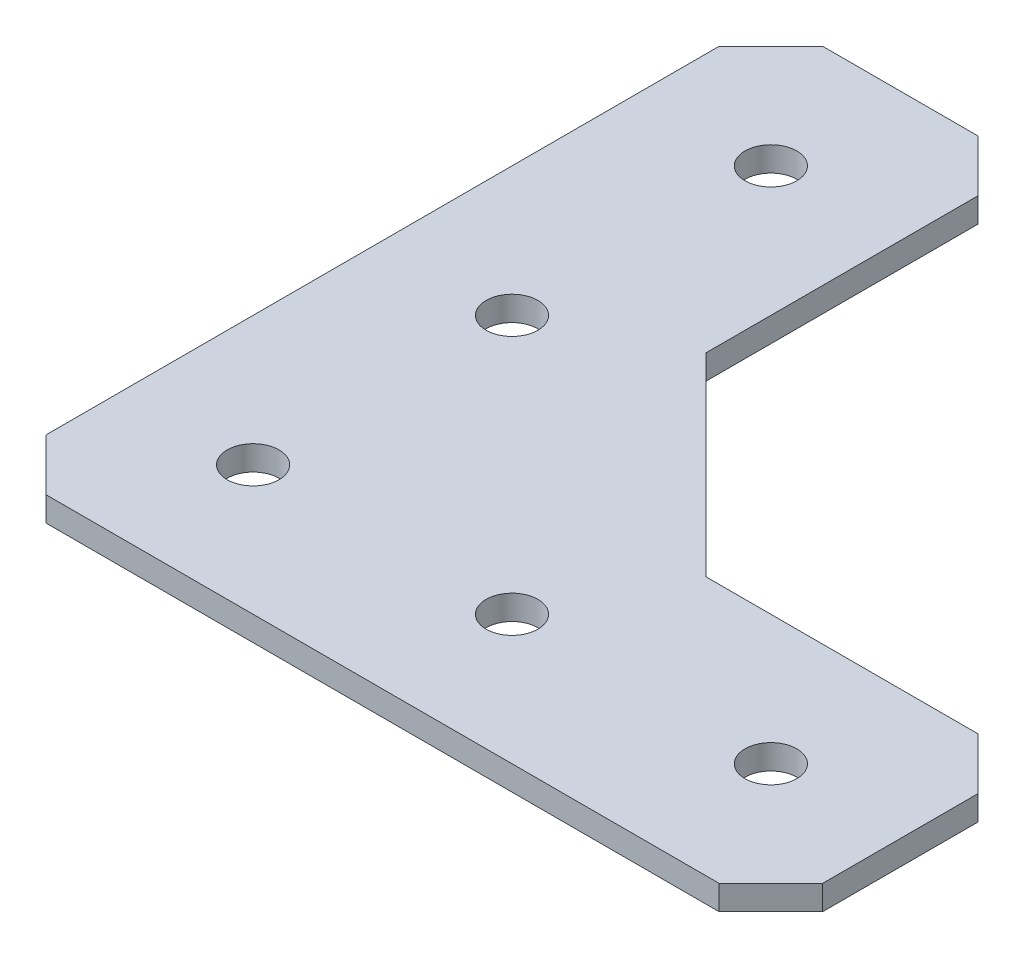
from build123d import *

# Parameters (mm, degrees)
BOSS_EXTRUDE1_DEPTH     = 2.413
CHAMFER1_SIZE           = 19.05
CHAMFER2_SIZE           = 5.08
CUT_EXTRUDE1_DEPTH      = 108.790085671
CUT_EXTRUDE1_DEPTH_BACK = 108.790085671
SKETCH2_R               = 2.54


with BuildPart() as part:
    # Sketch1 → Boss-Extrude1 (new body)
    with BuildSketch(Plane(origin=(0, 0, 0), x_dir=(1, 0, 0), z_dir=(0, 1, 0))):
        Polygon((25.4, 76.2), (25.4, 25.4), (76.2, 25.4), (76.2, 0), (0, 0), (0, 76.2), align=None)
    extrude(amount=BOSS_EXTRUDE1_DEPTH)

    # Chamfer1
    chamfer1_edges = [part.edges().sort_by_distance(p)[0] for p in [
        (25.4, 1.2065, -25.4),
    ]]
    chamfer(chamfer1_edges, length=CHAMFER1_SIZE)

    # Chamfer2
    chamfer2_edges = [part.edges().sort_by_distance(p)[0] for p in [
        (0, 1.2065, -76.2),
        (25.4, 1.2065, -76.2),
        (76.2, 1.2065, -25.4),
        (76.2, 1.2065, 0),
        (0, 1.2065, 0),
    ]]
    chamfer(chamfer2_edges, length=CHAMFER2_SIZE)

    # Sketch2 → Cut-Extrude1 (cut, two sides: drawn at the far end of the back side and taken through both)
    with BuildSketch(Plane(origin=(0, 0, 0), x_dir=(1, 0, 0), z_dir=(0, 1, 0)).offset(-CUT_EXTRUDE1_DEPTH_BACK)):
        with Locations(Location((12.7, 12.7, 0), (0, 0, 270))):
            Circle(SKETCH2_R)
        with Locations(Location((12.7, 38.1, 0), (0, 0, 270))):
            Circle(SKETCH2_R)
        with Locations(Location((38.1, 12.7, 0), (0, 0, 270))):
            Circle(SKETCH2_R)
        with Locations(Location((12.7, 63.5, 0), (0, 0, 270))):
            Circle(SKETCH2_R)
        with Locations(Location((63.5, 12.7, 0), (0, 0, 270))):
            Circle(SKETCH2_R)
    extrude(amount=CUT_EXTRUDE1_DEPTH + CUT_EXTRUDE1_DEPTH_BACK, mode=Mode.SUBTRACT)


solid = part.part
